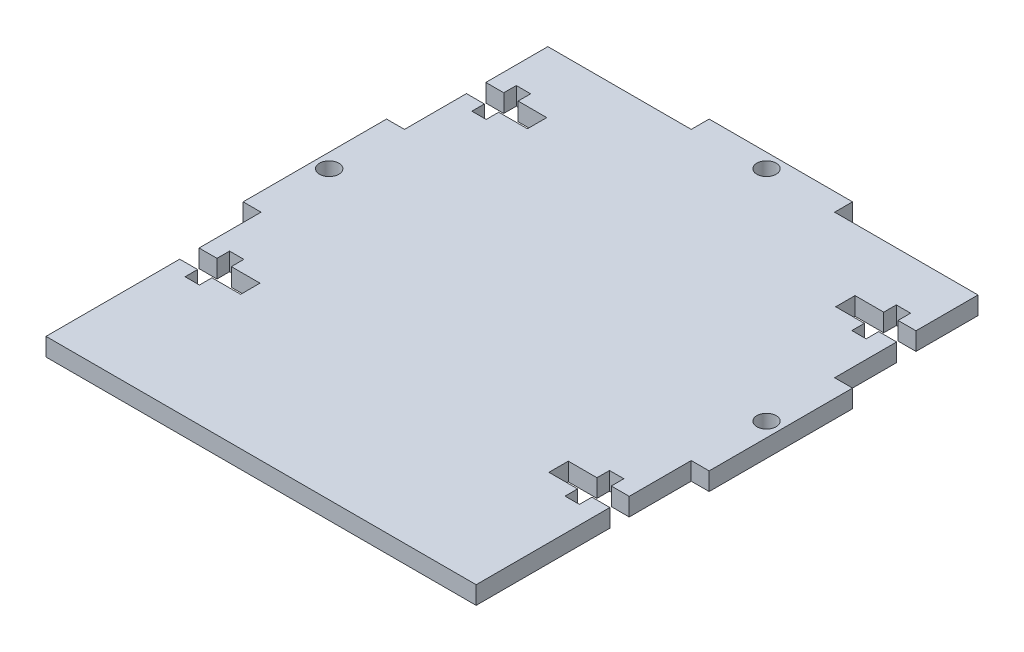
from build123d import *

# Parameters (mm, degrees)
SKETCH1_R           = 1.7145
BOSS_EXTRUDE1_DEPTH = 3.175


with BuildPart() as part:
    # Sketch1 → Boss-Extrude1 (new body)
    with BuildSketch(Plane(origin=(0, 0, 0), x_dir=(1, 0, 0), z_dir=(0, 1, 0))):
        Polygon((-38.1, 0), (-38.1, 23.6855), (-34.925, 23.6855), (-34.925, 21.463), (-32.385, 21.463), (-32.385, 23.6855), (-27.305, 23.6855), (-27.305, 27.1145), (-32.385, 27.1145), (-32.385, 29.337), (-34.925, 29.337), (-34.925, 27.1145), (-38.1, 27.1145), (-38.1, 38.1), (-41.275, 38.1), (-41.275, 63.5), (-38.1, 63.5), (-38.1, 74.4855), (-34.925, 74.4855), (-34.925, 72.263), (-32.385, 72.263), (-32.385, 74.4855), (-27.305, 74.4855), (-27.305, 77.9145), (-32.385, 77.9145), (-32.385, 80.137), (-34.925, 80.137), (-34.925, 77.9145), (-38.1, 77.9145), (-38.1, 88.9), (-12.7, 88.9), (-12.7, 92.075), (12.7, 92.075), (12.7, 88.9), (38.1, 88.9), (38.1, 77.9145), (34.925, 77.9145), (34.925, 80.137), (32.385, 80.137), (32.385, 77.9145), (27.305, 77.9145), (27.305, 74.4855), (32.385, 74.4855), (32.385, 72.263), (34.925, 72.263), (34.925, 74.4855), (38.1, 74.4855), (38.1, 63.5), (41.275, 63.5), (41.275, 38.1), (38.1, 38.1), (38.1, 27.1145), (34.925, 27.1145), (34.925, 29.337), (32.385, 29.337), (32.385, 27.1145), (27.305, 27.1145), (27.305, 23.6855), (32.385, 23.6855), (32.385, 21.463), (34.925, 21.463), (34.925, 23.6855), (38.1, 23.6855), (38.1, 0), align=None)
        with Locations(Location((-38.735, 50.8, 0), (0, 0, 270))):
            Circle(SKETCH1_R, mode=Mode.SUBTRACT)
        with Locations(Location((0, 89.535, 0), (0, 0, 270))):
            Circle(SKETCH1_R, mode=Mode.SUBTRACT)
        with Locations(Location((38.735, 50.8, 0), (0, 0, 270))):
            Circle(SKETCH1_R, mode=Mode.SUBTRACT)
    extrude(amount=BOSS_EXTRUDE1_DEPTH)


solid = part.part
